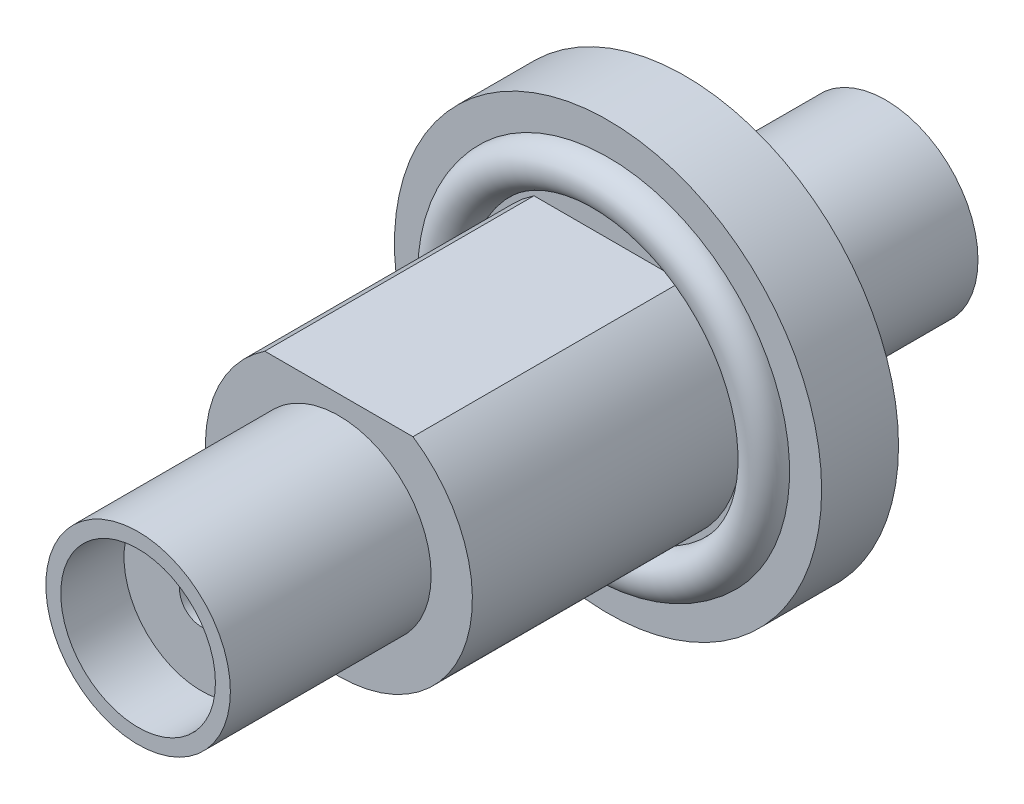
from build123d import *

# Parameters (mm, degrees)
SKETCH1_R          = 6.35
EXTRUDE1_DEPTH     = 2.286
SKETCH2_R          = 2.7432
EXTRUDE2_DEPTH     = 5.969
SKETCH3_R          = 2.2987
CUT_EXTRUDE1_DEPTH = 1.8796
SKETCH4_R          = 0.6477
CUT_EXTRUDE2_DEPTH = 4.0894
SKETCH5_R          = 3.96875
EXTRUDE3_DEPTH     = 8.001
EXTRUDE4_START     = 5.969
SKETCH6_R          = 2.7432
EXTRUDE4_DEPTH     = 5.969
CUT_EXTRUDE3_START = -1.8796
SKETCH7_R          = 2.2987
CUT_EXTRUDE3_DEPTH = 1.8796
CUT_EXTRUDE4_START = -12.0904
SKETCH8_R          = 0.6477
CUT_EXTRUDE4_DEPTH = 12.0904
SKETCH9_W          = 0.635
SKETCH9_H          = 1.27
SKETCH12_W         = 7.9375
SKETCH12_H         = 8.001
CUT_EXTRUDE5_DEPTH = 20.943448548
SKETCH10_R         = 0.635


with BuildPart() as part:
    # Sketch1 → Extrude1 (new body)
    with BuildSketch(Plane.XY):
        Circle(SKETCH1_R)
    extrude(amount=EXTRUDE1_DEPTH)

    # Sketch2 → Extrude2 (add)
    with BuildSketch(Plane(origin=(0, 0, 0), x_dir=(-1, 0, 0), z_dir=(0, 0, -1))):
        with Locations(Location((0, 0, 0), (0, 0, 180))):
            Circle(SKETCH2_R)
    extrude(amount=EXTRUDE2_DEPTH)

    # Sketch3 → Cut-Extrude1 (cut)
    with BuildSketch(Plane(origin=(0, 0, -5.969), x_dir=(-1, 0, 0), z_dir=(0, 0, -1))):
        Circle(SKETCH3_R)
    extrude(amount=-CUT_EXTRUDE1_DEPTH, mode=Mode.SUBTRACT)

    # Sketch4 → Cut-Extrude2 (cut)
    with BuildSketch(Plane(origin=(0, 0, -4.0894), x_dir=(-1, 0, 0), z_dir=(0, 0, -1))):
        Circle(SKETCH4_R)
    extrude(amount=-CUT_EXTRUDE2_DEPTH, mode=Mode.SUBTRACT)

    # Sketch5 → Extrude3 (add)
    with BuildSketch(Plane.XY.offset(2.286)):
        Circle(SKETCH5_R)
    extrude(amount=EXTRUDE3_DEPTH)

    # Sketch6 → Extrude4 (add)
    with BuildSketch(Plane.XY.offset(10.287).offset(EXTRUDE4_START)):
        Circle(SKETCH6_R)
    extrude(amount=-EXTRUDE4_DEPTH)

    # Sketch7 → Cut-Extrude3 (cut)
    with BuildSketch(Plane.XY.offset(16.256).offset(CUT_EXTRUDE3_START)):
        with Locations(Location((0, 0, 0), (0, 0, 180))):
            Circle(SKETCH7_R)
    extrude(amount=CUT_EXTRUDE3_DEPTH, mode=Mode.SUBTRACT)

    # Sketch8 → Cut-Extrude4 (cut)
    with BuildSketch(Plane.XY.offset(14.3764).offset(CUT_EXTRUDE4_START)):
        with Locations(Location((0, 0, 0), (0, 0, 180))):
            Circle(SKETCH8_R)
    extrude(amount=CUT_EXTRUDE4_DEPTH, mode=Mode.SUBTRACT)

    # Sketch9 → Cut-Revolve1 (revolve, cut)
    with BuildSketch(Plane(origin=(0, 0, 0), x_dir=(0, 0, -1), z_dir=(1, 0, 0)), mode=Mode.PRIVATE) as cut_revolve1_sk:
        with Locations((-1.9685, 4.7625)):
            Rectangle(SKETCH9_W, SKETCH9_H)
    revolve(cut_revolve1_sk.sketch.rotate(Axis((0, 0, -7.08025), (0, 0, 1)), 270), axis=Axis((0, 0, -7.08025), (0, 0, 1)), mode=Mode.SUBTRACT)

    # Sketch12 → Cut-Extrude5 (cut, through all)
    with BuildSketch(Plane(origin=(0, 3.302, 0), x_dir=(-1, 0, 0), z_dir=(0, 1, 0))):
        with Locations((0, 6.2865)):
            Rectangle(SKETCH12_W, SKETCH12_H)
    extrude(amount=CUT_EXTRUDE5_DEPTH, mode=Mode.SUBTRACT)


with BuildPart() as body_2:
    # Sketch10 → Revolve1 (revolve)
    with BuildSketch(Plane(origin=(0, 0, 0), x_dir=(0, 0, -1), z_dir=(1, 0, 0)), mode=Mode.PRIVATE) as revolve1_sk:
        with Locations((-2.286, 4.7625)):
            Circle(SKETCH10_R)
    revolve(revolve1_sk.sketch.rotate(Axis((0, 0, -7.08025), (0, 0, 1)), 90), axis=Axis((0, 0, -7.08025), (0, 0, 1)))


solid = Compound([part.part, body_2.part])
